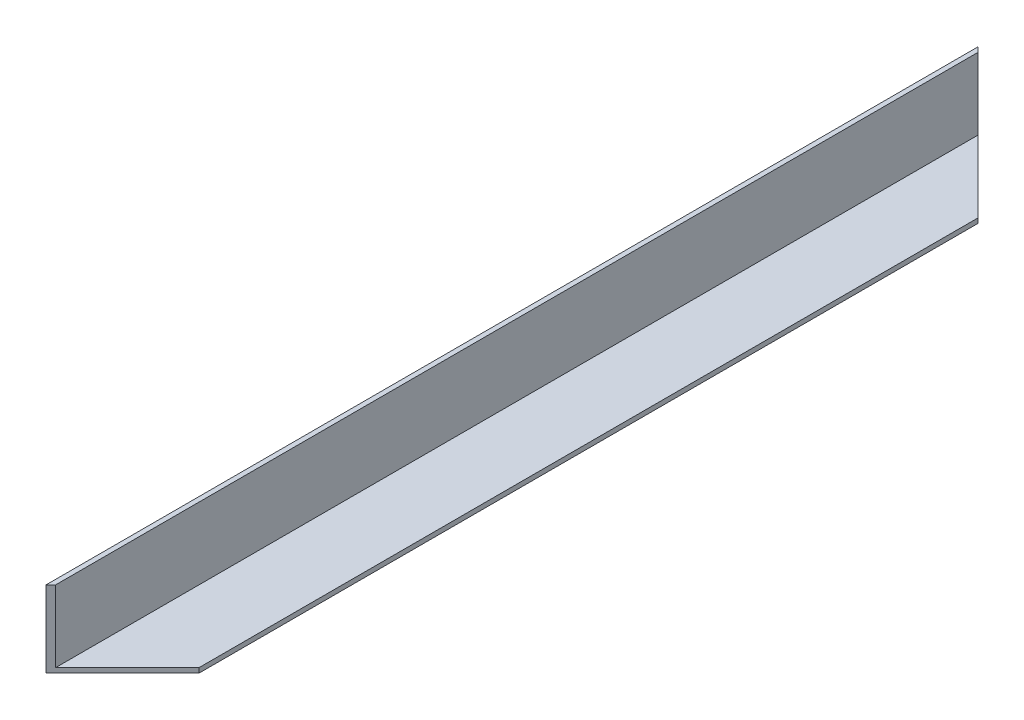
from build123d import *

# Parameters (mm, degrees)
EXTRUDE_THIN1_DEPTH = 390
CUT_EXTRUDE1_DEPTH  = 393.458915047


with BuildPart() as part:
    # Sketch1 → Extrude-Thin1 (new body)
    with BuildSketch(Plane.XY):
        Polygon((30, 0), (0, 0), (0, 30), (-2, 30), (-2, -2), (30, -2), align=None)
    extrude(amount=EXTRUDE_THIN1_DEPTH)

    # Sketch2 → Cut-Extrude1 (cut, through all)
    with BuildSketch(Plane.XZ.offset(2)):
        Polygon((-2, 0), (30, 32), (30, 0), align=None)
        Polygon((30, 358), (30, 390), (-2, 390), align=None)
    extrude(amount=-CUT_EXTRUDE1_DEPTH, mode=Mode.SUBTRACT)


solid = part.part
